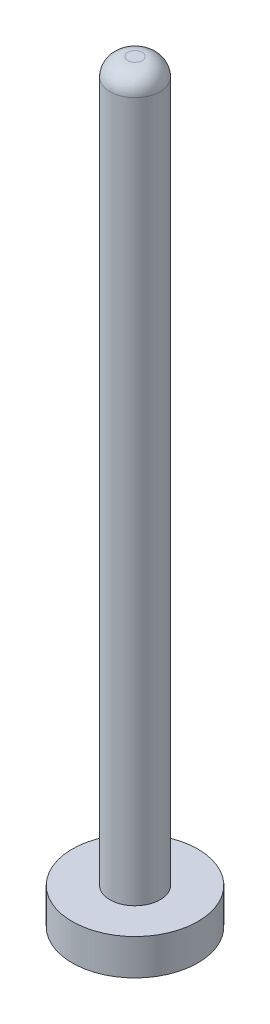
from build123d import *

# Parameters (mm, degrees)
SKETCH1_R           = 1.4
BOSS_EXTRUDE1_DEPTH = 40
SKETCH2_R           = 3.5
BOSS_EXTRUDE2_DEPTH = 2
FILLET2_R           = 1


with BuildPart() as part:
    # Sketch1 → Boss-Extrude1 (new body)
    with BuildSketch(Plane(origin=(0, 0, 0), x_dir=(1, 0, 0), z_dir=(0, 1, 0))):
        with Locations(Location((0, 0, 0), (0, 0, 270))):
            Circle(SKETCH1_R)
    extrude(amount=BOSS_EXTRUDE1_DEPTH)

    # Sketch2 → Boss-Extrude2 (add)
    with BuildSketch(Plane.XZ):
        with Locations(Location((0, 0, 0), (0, 0, 270))):
            Circle(SKETCH2_R)
    extrude(amount=BOSS_EXTRUDE2_DEPTH)

    # Fillet2
    fillet2_edges = [part.edges().sort_by_distance(p)[0] for p in [
        (0, 40, -1.4),
    ]]
    fillet(fillet2_edges, radius=FILLET2_R)


solid = part.part
